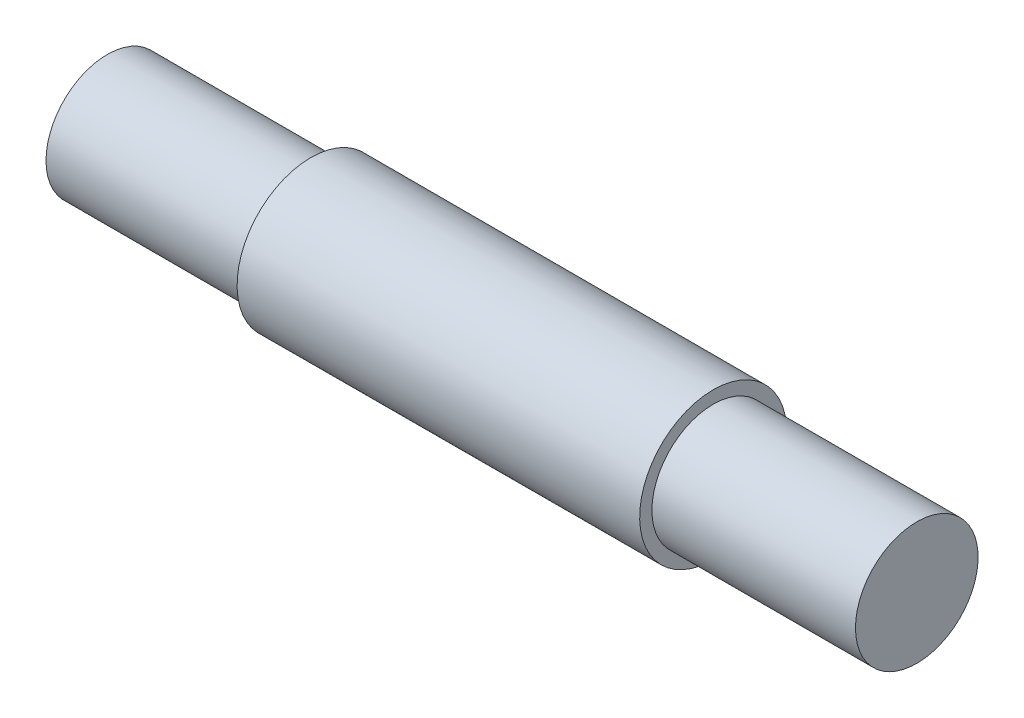
from build123d import *

# Parameters (mm, degrees)
SKETCH1_W = 330
SKETCH1_H = 25


with BuildPart() as part:
    # Sketch1 → Revolve1 (revolve)
    with BuildSketch(Plane.XY, mode=Mode.PRIVATE) as revolve1_sk:
        with Locations((0, 12.5)):
            Rectangle(SKETCH1_W, SKETCH1_H)
    revolve(revolve1_sk.sketch.rotate(Axis((-165, 0, 0), (1, 0, 0)), 90), axis=Axis((-165, 0, 0), (1, 0, 0)))

    # Sketch2 → Revolve2 (revolve)
    with BuildSketch(Plane.XY):
        Polygon((-82, 0), (-82, 30.119743804), (82, 30.119743804), (82, 0.119743804), align=None)
    revolve(axis=Axis((82, 0.119743804, 0), (-0.9999997334441394, -0.0007301449514384814, 0)))


solid = part.part
